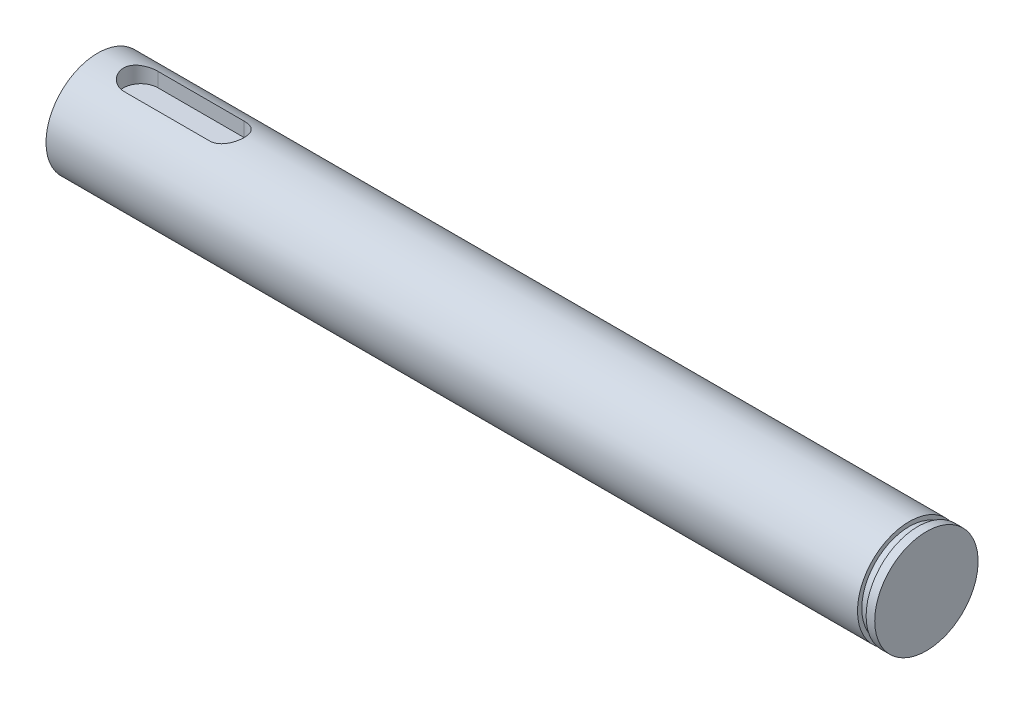
from build123d import *

# Parameters (mm, degrees)
CUT_EXTRUDE_1_DEPTH = 2


with BuildPart() as part:
    # ｽｹｯﾁ2 → 回転1 (revolve)
    with BuildSketch(Plane.XY, mode=Mode.PRIVATE) as revolve_1_sk:
        Polygon((0, 6), (0, 0), (96.2, 0), (96.2, 6), (95.2, 6), (95.2, 5.5), (94.2, 5.5), (94.2, 6), (2, 6), (1, 6), align=None)
    revolve(revolve_1_sk.sketch.rotate(Axis((0, 0, 0), (1, 0, 0)), 90), axis=Axis((0, 0, 0), (1, 0, 0)))

    # ｽｹｯﾁ4 → ｶｯﾄ - 押し出し1 (cut)
    with BuildSketch(Plane(origin=(0, 6, 0), x_dir=(1, 0, 0), z_dir=(0, 1, 0))):
        with BuildLine():
            Line((5, 2), (15, 2))
            ThreePointArc((15, 2), (17, 0), (15, -2))
            Line((15, -2), (5, -2))
            ThreePointArc((5, -2), (3, 0), (5, 2))
        make_face()
    extrude(amount=-CUT_EXTRUDE_1_DEPTH, mode=Mode.SUBTRACT)


solid = part.part
